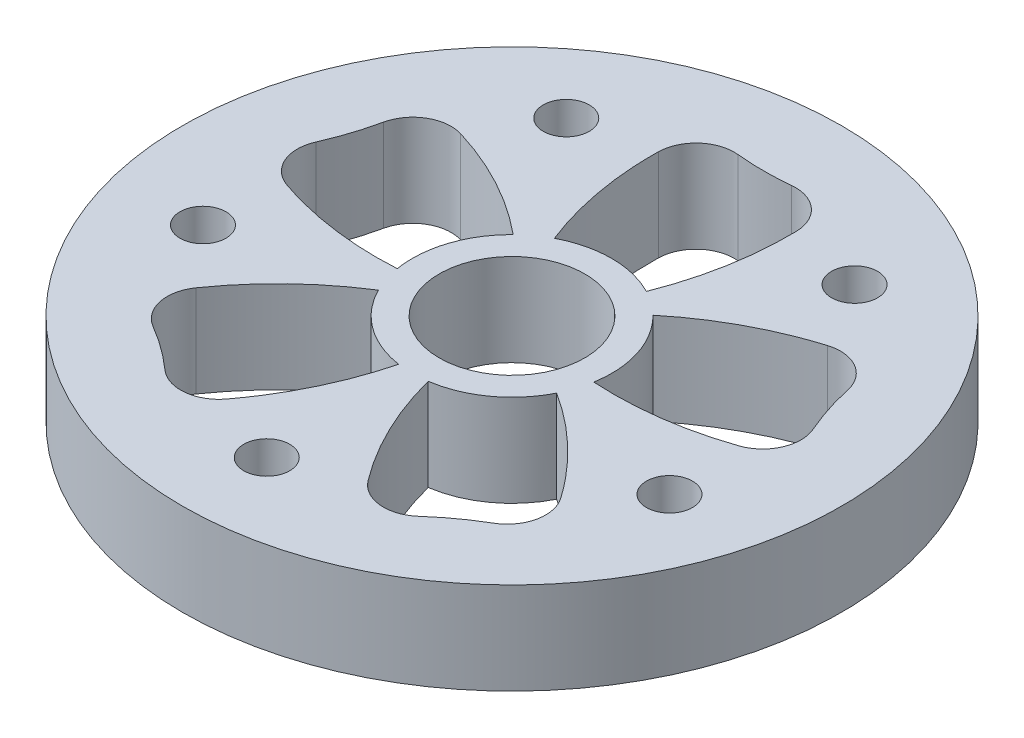
from build123d import *

# Parameters (mm, degrees)
SKETCH1_R               = 43
SKETCH1_R_2             = 9.5
SKETCH1_R_3             = 3
BOSS_EXTRUDE1_DEPTH     = 6
CUT_EXTRUDE1_DEPTH      = 62.983868869
CUT_EXTRUDE1_DEPTH_BACK = 62.983868869


with BuildPart() as part:
    # Sketch1 → Boss-Extrude1 (new, symmetric)
    with BuildSketch(Plane(origin=(0, 0, 0), x_dir=(1, 0, 0), z_dir=(0, 1, 0))):
        with Locations(Location((0, 0, 0), (0, 0, 270))):
            Circle(SKETCH1_R)
        with Locations(Location((0, 0, 0), (0, 0, 270))):
            Circle(SKETCH1_R_2, mode=Mode.SUBTRACT)
        with Locations(Location((0, -32, 0), (0, 0, 270))):
            Circle(SKETCH1_R_3, mode=Mode.SUBTRACT)
        with Locations(Location((-30.433808521, -9.88854382, 0), (0, 0, 270))):
            Circle(SKETCH1_R_3, mode=Mode.SUBTRACT)
        with Locations(Location((-18.809128073, 25.88854382, 0), (0, 0, 270))):
            Circle(SKETCH1_R_3, mode=Mode.SUBTRACT)
        with Locations(Location((18.809128073, 25.88854382, 0), (0, 0, 270))):
            Circle(SKETCH1_R_3, mode=Mode.SUBTRACT)
        with Locations(Location((30.433808521, -9.88854382, 0), (0, 0, 270))):
            Circle(SKETCH1_R_3, mode=Mode.SUBTRACT)
    extrude(amount=BOSS_EXTRUDE1_DEPTH, both=True)

    # Sketch2 → Cut-Extrude1 (cut, two sides: drawn at the far end of the back side and taken through both)
    with BuildSketch(Plane(origin=(0, 6, 0), x_dir=(1, 0, 0), z_dir=(0, 1, 0)).offset(-CUT_EXTRUDE1_DEPTH_BACK)):
        with BuildLine():
            ThreePointArc((-9.114016839, 9.270096928), (-12.363734712, 4.017220927), (-12.822220771, -2.142581267))
            ThreePointArc((-12.822220771, -2.142581267), (-21.270303496, -1.833512485), (-29.494654795, 0.122419764))
            ThreePointArc((-29.494654795, 0.122419764), (-32.446074444, 2.845461233), (-32.44271131, 6.861158119))
            ThreePointArc((-32.44271131, 6.861158119), (-31.194730701, 10.135782424), (-30.27959235, 13.518553733))
            ThreePointArc((-30.27959235, 13.518553733), (-27.921945775, 16.769297559), (-23.933633504, 17.23748344))
            ThreePointArc((-23.933633504, 17.23748344), (-16.130325405, 13.985713467), (-9.114016839, 9.270096928))
        make_face()
        with BuildLine():
            ThreePointArc((6, 11.532562595), (0, 13), (-6, 11.532562595))
            ThreePointArc((-6, 11.532562595), (-8.316659253, 19.662674227), (-8.99792146, 28.088913426))
            ThreePointArc((-8.99792146, 28.088913426), (-7.320193957, 31.737346406), (-3.5, 32.975066458))
            ThreePointArc((-3.5, 32.975066458), (0, 32.800080928), (3.5, 32.975066458))
            ThreePointArc((3.5, 32.975066458), (7.320193957, 31.737346406), (8.99792146, 28.088913426))
            ThreePointArc((8.99792146, 28.088913426), (8.316659253, 19.662674227), (6, 11.532562595))
        make_face()
        with BuildLine():
            ThreePointArc((12.822220771, -2.142581267), (12.363734712, 4.017220927), (9.114016839, 9.270096928))
            ThreePointArc((9.114016839, 9.270096928), (16.130325405, 13.985713467), (23.933633504, 17.23748344))
            ThreePointArc((23.933633504, 17.23748344), (27.921945775, 16.769297559), (30.27959235, 13.518553733))
            ThreePointArc((30.27959235, 13.518553733), (31.194730701, 10.135782424), (32.44271131, 6.861158119))
            ThreePointArc((32.44271131, 6.861158119), (32.446074444, 2.845461233), (29.494654795, 0.122419764))
            ThreePointArc((29.494654795, 0.122419764), (21.270303496, -1.833512485), (12.822220771, -2.142581267))
        make_face()
        with BuildLine():
            ThreePointArc((-1.924568248, -12.856750642), (-4.829111259, -20.795847261), (-9.230777689, -28.013253851))
            ThreePointArc((-9.230777689, -28.013253851), (-12.732582852, -29.978754651), (-16.550698277, -28.734637538))
            ThreePointArc((-16.550698277, -28.734637538), (-19.279403843, -26.535822888), (-22.213817238, -24.620140772))
            ThreePointArc((-22.213817238, -24.620140772), (-24.576905478, -21.373350548), (-23.78972044, -17.435562779))
            ThreePointArc((-23.78972044, -17.435562779), (-18.285748603, -11.019027947), (-11.632772181, -5.803327614))
            ThreePointArc((-11.632772181, -5.803327614), (-7.64120828, -10.517220927), (-1.924568248, -12.856750642))
        make_face()
        with BuildLine():
            ThreePointArc((1.924568248, -12.856750642), (7.64120828, -10.517220927), (11.632772181, -5.803327614))
            ThreePointArc((11.632772181, -5.803327614), (18.285748603, -11.019027947), (23.78972044, -17.435562779))
            ThreePointArc((23.78972044, -17.435562779), (24.576905478, -21.373350548), (22.213817238, -24.620140772))
            ThreePointArc((22.213817238, -24.620140772), (19.279403843, -26.535822888), (16.550698277, -28.734637538))
            ThreePointArc((16.550698277, -28.734637538), (12.732582852, -29.978754651), (9.230777689, -28.013253851))
            ThreePointArc((9.230777689, -28.013253851), (4.829111259, -20.795847261), (1.924568248, -12.856750642))
        make_face()
    extrude(amount=CUT_EXTRUDE1_DEPTH + CUT_EXTRUDE1_DEPTH_BACK, mode=Mode.SUBTRACT)


solid = part.part
